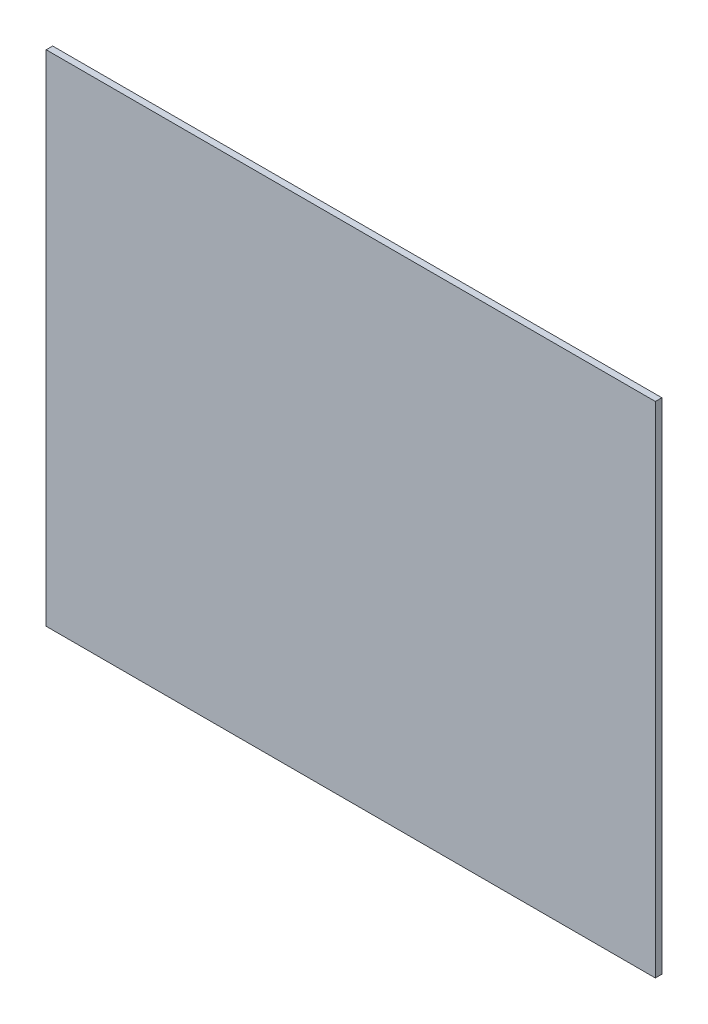
from build123d import *

# Parameters (mm, degrees)
SKETCH1_W           = 61
SKETCH1_H           = 50
BOSS_EXTRUDE1_DEPTH = 0.65


with BuildPart() as part:
    # Sketch1 → Boss-Extrude1 (new body)
    with BuildSketch(Plane.XY):
        with Locations((30.5, 25)):
            Rectangle(SKETCH1_W, SKETCH1_H)
    extrude(amount=BOSS_EXTRUDE1_DEPTH)


solid = part.part
